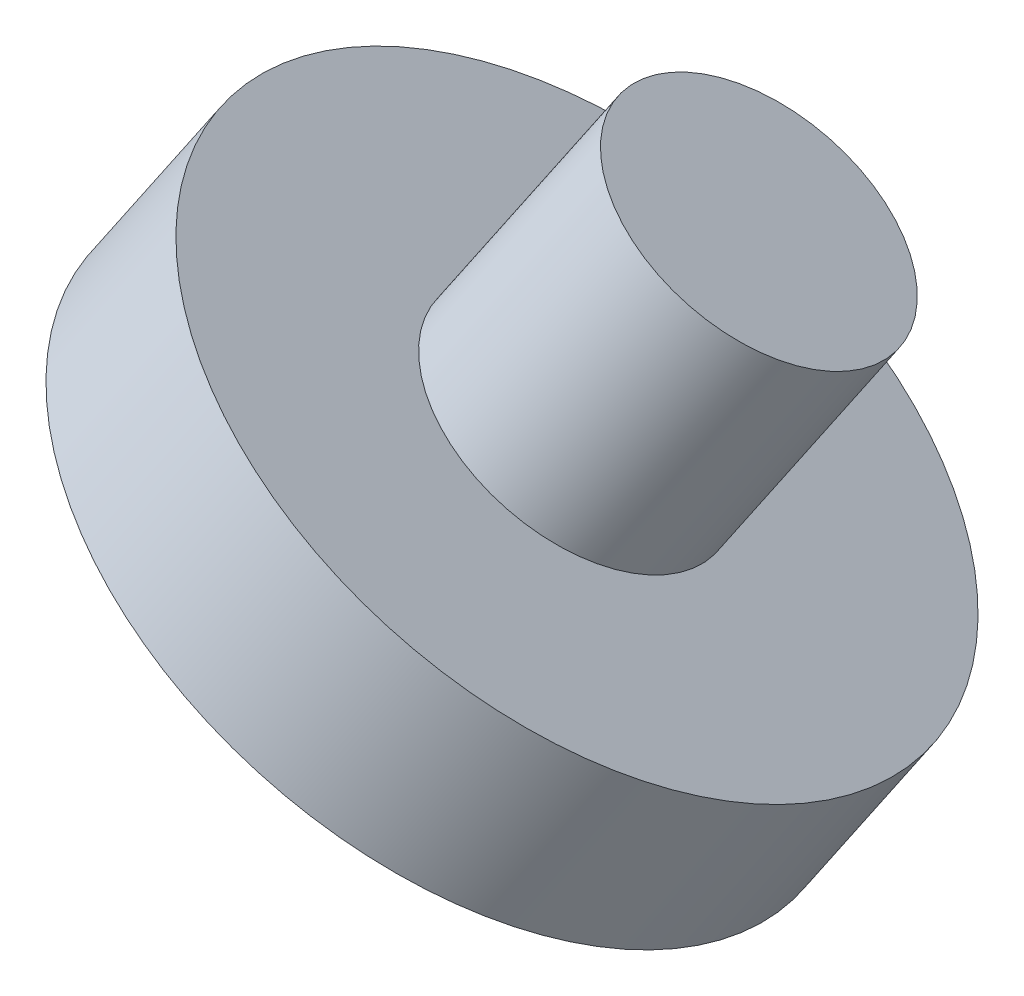
from build123d import *

# Parameters (mm, degrees)
SKETCH1_R           = 10
BOSS_EXTRUDE1_DEPTH = 5
SKETCH2_R           = 3.95
BOSS_EXTRUDE2_DEPTH = 7


with BuildPart() as part:
    # Sketch1 → Boss-Extrude1 (new body)
    with BuildSketch(Plane(origin=(-109.434541397, -193.452902775, 69.684877721), x_dir=(0.8794168923998651, -0.46981927431759296, 0.07678397516054071), z_dir=(0.4698192743176199, 0.8305229887778682, -0.29916787025204106))):
        with Locations(Location((52.987730107, -483.544948633, 0), (0, 0, 4.615549401))):
            Circle(SKETCH1_R)
    extrude(amount=BOSS_EXTRUDE1_DEPTH)

    # Sketch2 → Boss-Extrude2 (add)
    with BuildSketch(Plane(origin=(-107.085445025, -189.300287832, 68.18903837), x_dir=(0.879416892399865, -0.4698192743175933, 0.07678397516054022), z_dir=(0.4698192743176201, 0.8305229887778682, -0.2991678702520411))):
        with Locations(Location((52.987730107, -483.544948633, 0), (0, 0, 184.615549401))):
            Circle(SKETCH2_R)
    extrude(amount=BOSS_EXTRUDE2_DEPTH)


solid = part.part
